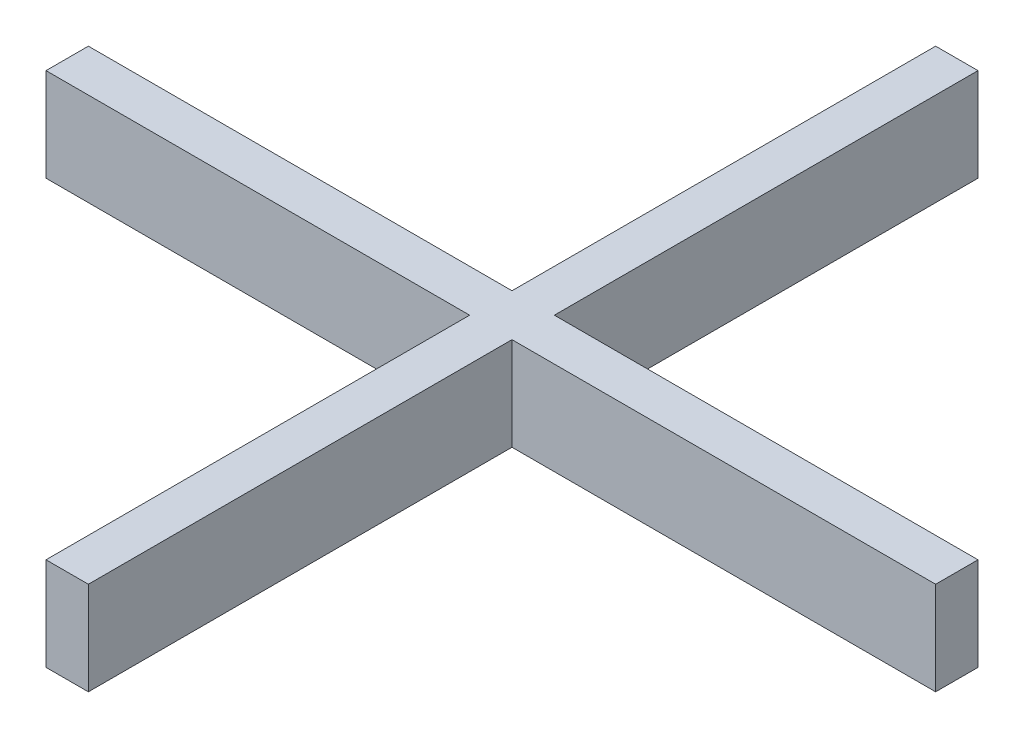
from build123d import *

# Parameters (mm, degrees)
BOSS_EXTRUDE1_DEPTH = 1.1


with BuildPart() as part:
    # Sketch1 → Boss-Extrude1 (new, symmetric)
    with BuildSketch(Plane(origin=(0, 0, 0), x_dir=(1, 0, 0), z_dir=(0, 1, 0))):
        Polygon((-10.5, 0.5), (-0.5, 0.5), (-0.5, 10.5), (0.5, 10.5), (0.5, 0.5), (10.5, 0.5), (10.5, -0.5), (0.5, -0.5), (0.5, -10.5), (-0.5, -10.5), (-0.5, -0.5), (-10.5, -0.5), align=None)
    extrude(amount=BOSS_EXTRUDE1_DEPTH, both=True)


solid = part.part
